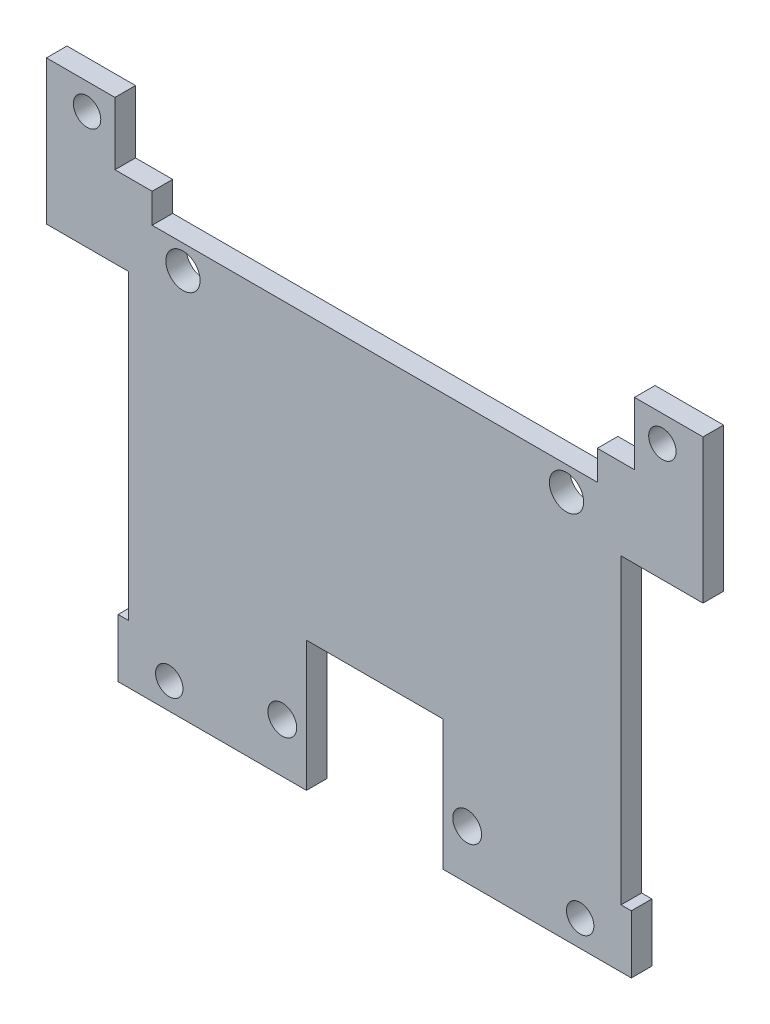
from build123d import *

# Parameters (mm, degrees)
EXTRUDE_1_DEPTH     = 3
SKETCH_3_R          = 2.5
SKETCH_3_R_2        = 2.1
CUT_EXTRUDE_1_DEPTH = 61.517481152
SKETCH_4_R          = 2
CUT_EXTRUDE_2_DEPTH = 10


with BuildPart() as part:
    # 草图2 → 凸台-拉伸1 (new body)
    with BuildSketch(Plane.XY):
        Polygon((32.5, 23.375), (-32.5, 23.375), (-32.5, 27.675), (-37.93, 27.675), (-37.93, 36.825), (-47.93, 36.825), (-47.93, 15.805), (-35.97, 15.805), (-35.97, -28.325), (-37.47, -28.325), (-37.47, -36.825), (-9.97, -36.825), (-9.97, -17.825), (9.97, -17.825), (9.97, -36.825), (37.47, -36.825), (37.47, -28.325), (35.97, -28.325), (35.97, 15.805), (47.93, 15.805), (47.93, 36.825), (37.93, 36.825), (37.93, 27.675), (32.5, 27.675), align=None)
    extrude(amount=EXTRUDE_1_DEPTH)

    # 草图3 → 切除-拉伸1 (cut, through all)
    with BuildSketch(Plane.XY.offset(3)):
        with Locations((-28, 19.875)):
            Circle(SKETCH_3_R)
        with Locations((-13.5, -29.625)):
            Circle(SKETCH_3_R_2)
        with Locations(Location((13.5, -29.625, 0), (0, 0, 180))):
            Circle(SKETCH_3_R_2)
        with Locations(Location((28, 19.875, 0), (0, 0, 180))):
            Circle(SKETCH_3_R)
    extrude(amount=-CUT_EXTRUDE_1_DEPTH, mode=Mode.SUBTRACT)

    # 草图4 → 切除-拉伸2 (cut)
    with BuildSketch(Plane.XY.offset(3)):
        with Locations((-42, 33)):
            Circle(SKETCH_4_R)
        with Locations((-30, -33)):
            Circle(SKETCH_4_R)
        with Locations((30, -33)):
            Circle(SKETCH_4_R)
        with Locations((42, 33)):
            Circle(SKETCH_4_R)
    extrude(amount=-CUT_EXTRUDE_2_DEPTH, mode=Mode.SUBTRACT)


solid = part.part
